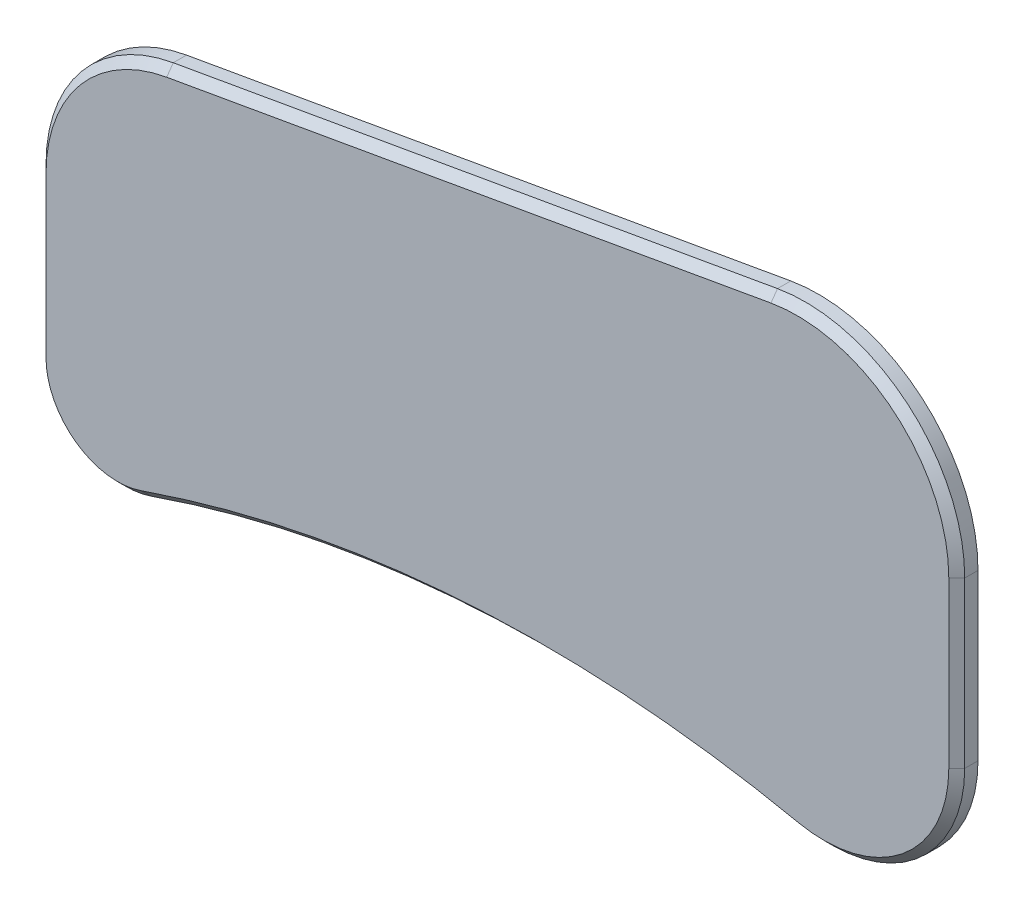
from build123d import *

# Parameters (mm, degrees)
BOSS_EXTRUDE1_DEPTH = 4
CHAMFER1_SIZE       = 1.5


with BuildPart() as part:
    # Sketch1 → Boss-Extrude1 (new body)
    with BuildSketch(Plane.XY):
        with BuildLine():
            Line((54.748665604, 40.101038648), (-59.035797152, 20.037767879))
            ThreePointArc((-59.035797152, 20.037767879), (-76.21528885, 10.119183723), (-83, -8.521656958))
            Line((-83, -8.521656958), (-83, -38.521656958))
            ThreePointArc((-83, -38.521656958), (-76.697736677, -50.742515222), (-63.086749774, -52.694164578))
            ThreePointArc((-63.086749774, -52.694164578), (-2.15504295, -40.457474253), (59.828407224, -44.980901185))
            ThreePointArc((59.828407224, -44.980901185), (80.743414188, -39.941876053), (90, -20.521656958))
            Line((90, -20.521656958), (90, 10.521656958))
            ThreePointArc((90, 10.521656958), (79.270878905, 33.530331398), (54.748665604, 40.101038648))
        make_face()
    extrude(amount=BOSS_EXTRUDE1_DEPTH)

    # Chamfer1
    chamfer1_edges = [part.edges().sort_by_distance(p)[0] for p in [
        (-76.21528885, 10.119183723, 4),
        (-83, -23.521656958, 4),
        (-76.697736677, -50.742515222, 4),
        (-2.15504295, -40.457474253, 4),
        (80.743414188, -39.941876053, 4),
        (90, -5, 4),
        (79.270878905, 33.530331398, 4),
        (-2.143565774, 30.069403264, 4),
    ]]
    chamfer(chamfer1_edges, length=CHAMFER1_SIZE)


solid = part.part
